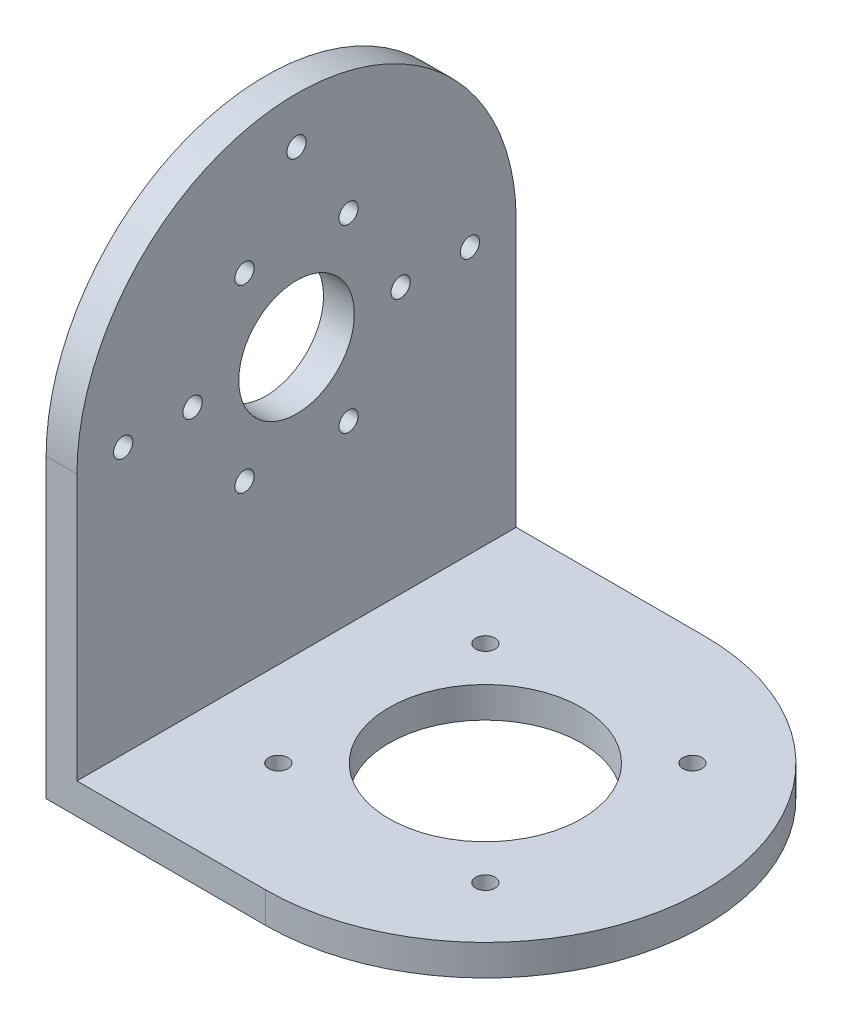
from build123d import *

# Parameters (mm, degrees)
EXTRUDE_1_DEPTH          = 57
CUT_EXTRUDE_1_DEPTH      = 57
CUT_EXTRUDE_2_DEPTH      = 57
SKETCH_5_R               = 7.5
SKETCH_5_R_2             = 1.25
CUT_EXTRUDE_3_DEPTH      = 57
PATTERN_CIRCULAR_1_COUNT = 6
SKETCH_6_R               = 12.5
SKETCH_6_R_2             = 1.25
CUT_EXTRUDE_4_DEPTH      = 57
PATTERN_CIRCULAR_2_COUNT = 4
SKETCH_7_R               = 1.25
CUT_EXTRUDE_5_DEPTH      = 10
PATTERN_CIRCULAR_3_COUNT = 3
PATTERN_CIRCULAR_3_ANGLE = 180


with BuildPart() as part:
    # 草图1 → 凸台-拉伸1 (new body)
    with BuildSketch(Plane.XY):
        Polygon((0, 67), (0, 0), (57, 0), (57, 4), (4, 4), (4, 67), align=None)
    extrude(amount=EXTRUDE_1_DEPTH)

    # 草图3 → 切除-拉伸1 (cut)
    with BuildSketch(Plane.XZ):
        with BuildLine():
            Line((57, 57), (28.5, 57))
            ThreePointArc((28.5, 57), (48.652543264, 48.652543264), (57, 28.5))
            Line((57, 28.5), (57, 57))
        make_face()
        with BuildLine():
            ThreePointArc((57, 28.5), (48.652543264, 8.347456736), (28.5, 0))
            Line((28.5, 0), (57, 0))
            Line((57, 0), (57, 28.5))
        make_face()
    extrude(amount=-CUT_EXTRUDE_1_DEPTH, mode=Mode.SUBTRACT)

    # 草图4 → 切除-拉伸2 (cut)
    with BuildSketch(Plane.ZY):
        with BuildLine():
            Line((57, 67), (28.5, 67))
            ThreePointArc((28.5, 67), (48.652543264, 58.652543264), (57, 38.5))
            Line((57, 38.5), (57, 67))
        make_face()
        with BuildLine():
            Line((28.5, 67), (0, 67))
            Line((0, 67), (0, 38.5))
            ThreePointArc((0, 38.5), (8.347456736, 58.652543264), (28.5, 67))
        make_face()
    extrude(amount=-CUT_EXTRUDE_2_DEPTH, mode=Mode.SUBTRACT)

    # 草图5 → 切除-拉伸3 (cut)
    with BuildSketch(Plane.ZY):
        with Locations((28.5, 38.5)):
            Circle(SKETCH_5_R)
        with Locations((42, 38.5)):
            Circle(SKETCH_5_R_2)
    cut_extrude_3 = extrude(amount=-CUT_EXTRUDE_3_DEPTH, mode=Mode.SUBTRACT)

    # 阵列(圆周)1: 切除-拉伸3 ×6 about axis
    pattern_circular_1_axis = Axis((0, 38.5, 28.5), (1, 0, 0))
    for i in range(1, PATTERN_CIRCULAR_1_COUNT):
        add(cut_extrude_3.rotate(pattern_circular_1_axis, i * 360 / PATTERN_CIRCULAR_1_COUNT), mode=Mode.SUBTRACT)

    # 草图6 → 切除-拉伸4 (cut)
    with BuildSketch(Plane.XZ):
        with Locations(Location((28.5, 28.5, 0), (0, 0, 270))):
            Circle(SKETCH_6_R)
        with Locations(Location((41.935028843, 41.935028843, 0), (0, 0, 270))):
            Circle(SKETCH_6_R_2)
    cut_extrude_4 = extrude(amount=-CUT_EXTRUDE_4_DEPTH, mode=Mode.SUBTRACT)

    # 阵列(圆周)2: 切除-拉伸4 ×4 about axis
    pattern_circular_2_axis = Axis((28.5, 0, 28.5), (0, 1, 0))
    for i in range(1, PATTERN_CIRCULAR_2_COUNT):
        add(cut_extrude_4.rotate(pattern_circular_2_axis, i * 360 / PATTERN_CIRCULAR_2_COUNT), mode=Mode.SUBTRACT)

    # 草图7 → 切除-拉伸5 (cut)
    with BuildSketch(Plane.ZY):
        with Locations((51, 38.5)):
            Circle(SKETCH_7_R)
    cut_extrude_5 = extrude(amount=-CUT_EXTRUDE_5_DEPTH, mode=Mode.SUBTRACT)

    # 阵列(圆周)3: 切除-拉伸5 ×3 about axis
    pattern_circular_3_axis = Axis((0, 38.5, 28.5), (-1, 0, 0))
    for i in range(1, PATTERN_CIRCULAR_3_COUNT):
        add(cut_extrude_5.rotate(pattern_circular_3_axis, i * PATTERN_CIRCULAR_3_ANGLE / (PATTERN_CIRCULAR_3_COUNT - 1)), mode=Mode.SUBTRACT)


solid = part.part
